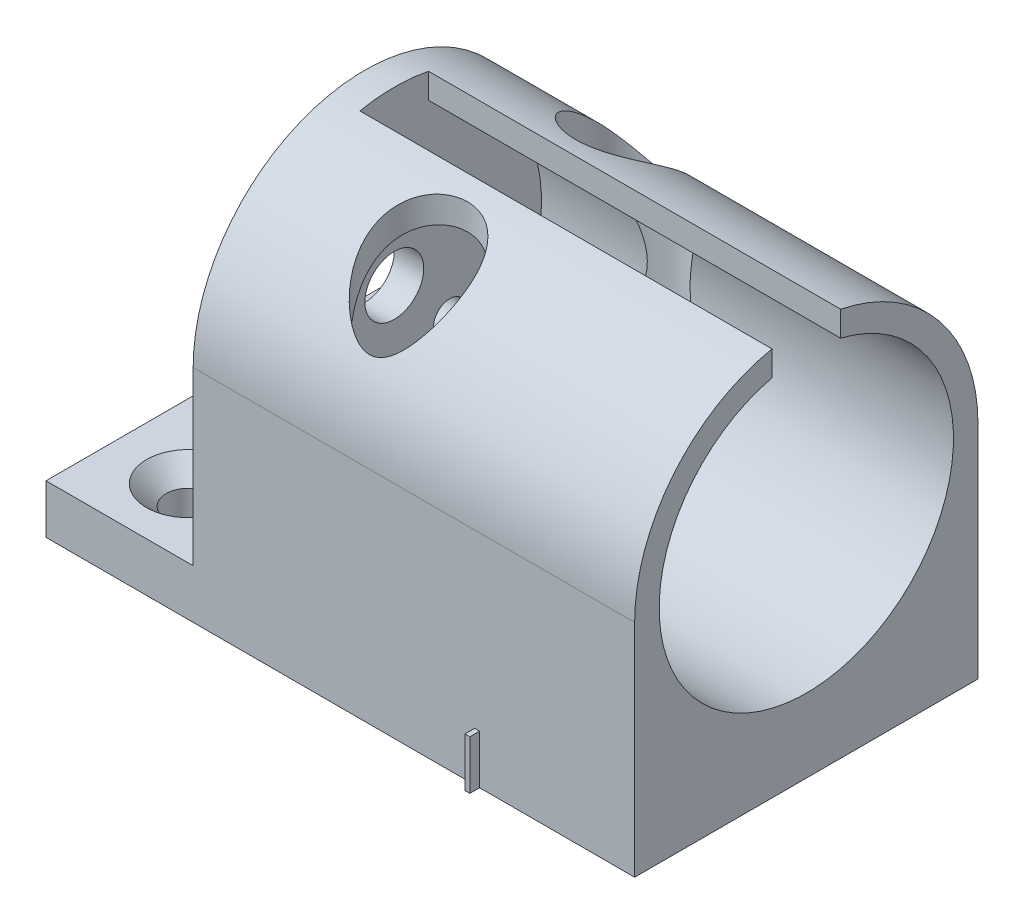
from build123d import *

# Parameters (mm, degrees)
BOSS_EXTRUDE1_DEPTH = 17.5
BOSS_EXTRUDE2_START = 1
SKETCH2_W           = 0.5
SKETCH2_H           = 5
BOSS_EXTRUDE2_DEPTH = 37
SKETCH3_R           = 3
SKETCH3_R_2         = 1.65
CUT_EXTRUDE1_DEPTH  = 54.605037077
SKETCH4_W           = 35
SKETCH4_H           = 35
SKETCH4_R           = 15
BOSS_EXTRUDE3_DEPTH = 42
CUT_EXTRUDE2_DEPTH  = 67.697076398
SKETCH6_R           = 5
CUT_EXTRUDE3_DEPTH  = 73.301452268
SKETCH7_R           = 2.25
CUT_EXTRUDE4_DEPTH  = 73.3014524
CHAMFER1_SIZE       = 2
SKETCH8_W           = 7
SKETCH8_H           = 2.914047854
CUT_EXTRUDE5_DEPTH  = 42


with BuildPart() as part:
    # Sketch1 → Boss-Extrude1 (new, symmetric)
    with BuildSketch(Plane.XY):
        Polygon((0.5, -17.5), (15.5, -17.5), (15.5, 17.5), (18.5, 17.5), (18.5, -17.5), (60.5, -17.5), (60.5, -22.5), (0.5, -22.5), align=None)
    extrude(amount=BOSS_EXTRUDE1_DEPTH, both=True)

    # Sketch2 → Boss-Extrude2 (add)
    with BuildSketch(Plane.XY.offset(17.5).offset(BOSS_EXTRUDE2_START)):
        with Locations((44.45, -20)):
            Rectangle(SKETCH2_W, SKETCH2_H)
    extrude(amount=-BOSS_EXTRUDE2_DEPTH)

    # Sketch3 → Cut-Extrude1 (cut, through all)
    with BuildSketch(Plane.ZY.offset(-15.5)):
        Circle(SKETCH3_R)
        with Locations((-5.656854249, 5.656854249)):
            Circle(SKETCH3_R_2)
        with Locations((5.656854249, 5.656854249)):
            Circle(SKETCH3_R_2)
        with Locations((5.656854249, -5.656854249)):
            Circle(SKETCH3_R_2)
        with Locations((-5.656854249, -5.656854249)):
            Circle(SKETCH3_R_2)
    extrude(amount=-CUT_EXTRUDE1_DEPTH, mode=Mode.SUBTRACT)

    # Sketch4 → Boss-Extrude3 (add, through all)
    with BuildSketch(Plane(origin=(18.5, 0, 0), x_dir=(0, 0, -1), z_dir=(1, 0, 0))):
        Rectangle(SKETCH4_W, SKETCH4_H)
        with Locations(Location((0, 0, 0), (0, 0, 180))):
            Circle(SKETCH4_R, mode=Mode.SUBTRACT)
    extrude(amount=BOSS_EXTRUDE3_DEPTH)

    # Sketch5 → Cut-Extrude2 (cut, through all)
    with BuildSketch(Plane(origin=(60.5, 0, 0), x_dir=(0, 0, -1), z_dir=(1, 0, 0))):
        with BuildLine():
            Line((-17.5, 0), (-17.5, 18.5))
            Line((-17.5, 18.5), (17.5, 18.5))
            Line((17.5, 18.5), (17.5, 0))
            ThreePointArc((17.5, 0), (0, 17.5), (-17.5, 0))
        make_face()
    extrude(amount=-CUT_EXTRUDE2_DEPTH, mode=Mode.SUBTRACT)

    # Sketch6 → Cut-Extrude3 (cut, through all)
    with BuildSketch(Plane(origin=(0, -17.5, 0), x_dir=(1, 0, 0), z_dir=(0, 1, 0))):
        with Locations(Location((31.475, -10.5, 0), (0, 0, 90))):
            Circle(SKETCH6_R)
        with Locations(Location((31.475, 10.5, 0), (0, 0, 90))):
            Circle(SKETCH6_R)
    extrude(amount=CUT_EXTRUDE3_DEPTH, mode=Mode.SUBTRACT)

    # Sketch7 → Cut-Extrude4 (cut, through all)
    with BuildSketch(Plane(origin=(0, -17.5, 0), x_dir=(1, 0, 0), z_dir=(0, 1, 0))):
        with Locations(Location((8, 10.5, 0), (0, 0, 270))):
            Circle(SKETCH7_R)
        with Locations(Location((8, -10.5, 0), (0, 0, 270))):
            Circle(SKETCH7_R)
        with Locations(Location((31.475, -10.5, 0), (0, 0, 270))):
            Circle(SKETCH7_R)
        with Locations(Location((31.475, 10.5, 0), (0, 0, 270))):
            Circle(SKETCH7_R)
    extrude(amount=-CUT_EXTRUDE4_DEPTH, mode=Mode.SUBTRACT)

    # Chamfer1
    chamfer1_edges = [part.edges().sort_by_distance(p)[0] for p in [
        (31.475, -17.5, 8.25),
        (8, -17.5, -12.75),
        (31.475, -17.5, -12.75),
        (8, -17.5, 8.25),
    ]]
    chamfer(chamfer1_edges, length=CHAMFER1_SIZE)

    # Sketch8 → Cut-Extrude5 (cut)
    with BuildSketch(Plane(origin=(60.5, 0, 0), x_dir=(0, 0, -1), z_dir=(1, 0, 0))):
        with Locations((0, 16.042976073)):
            Rectangle(SKETCH8_W, SKETCH8_H)
    extrude(amount=-CUT_EXTRUDE5_DEPTH, mode=Mode.SUBTRACT)


solid = part.part
